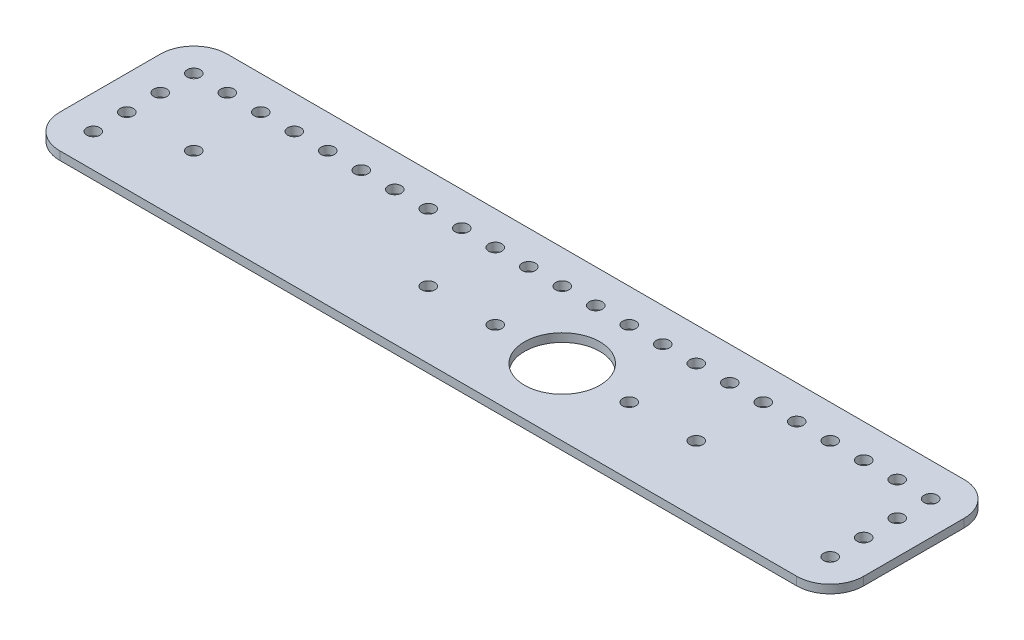
from build123d import *

# Parameters (mm, degrees)
SKETCH1_W           = 254
SKETCH1_H           = 38.1
SKETCH1_R           = 2.4892
BOSS_EXTRUDE1_DEPTH = 3.175
SKETCH3_R           = 2.4892
SKETCH3_R_2         = 14.2875
CUT_EXTRUDE1_DEPTH  = 312.36051552
FILLET1_R           = 12.7


with BuildPart() as part:
    # Sketch1 → Boss-Extrude1 (new body)
    # profile 1 of 2: a face of its own
    with BuildSketch(Plane(origin=(0, 0, 0), x_dir=(1, 0, 0), z_dir=(0, 1, 0))):
        with Locations((152.4, 19.05)):
            Rectangle(SKETCH1_W, SKETCH1_H)
    # profile 2 of 2: a face of its own
    with BuildSketch(Plane(origin=(0, 0, 0), x_dir=(1, 0, 0), z_dir=(0, 1, 0))):
        Polygon((0, 63.5), (0, 0), (25.4, 0), (25.4, 38.1), (279.4, 38.1), (279.4, 0), (304.8, 0), (304.8, 63.5), align=None)
        with Locations(Location((12.7, 12.7, 0), (0, 0, 270))):
            Circle(SKETCH1_R, mode=Mode.SUBTRACT)
        with Locations(Location((12.7, 25.4, 0), (0, 0, 270))):
            Circle(SKETCH1_R, mode=Mode.SUBTRACT)
        with Locations(Location((292.1, 12.7, 0), (0, 0, 270))):
            Circle(SKETCH1_R, mode=Mode.SUBTRACT)
        with Locations(Location((292.1, 25.4, 0), (0, 0, 270))):
            Circle(SKETCH1_R, mode=Mode.SUBTRACT)
        with Locations(Location((12.7, 38.1, 0), (0, 0, 270))):
            Circle(SKETCH1_R, mode=Mode.SUBTRACT)
        with Locations(Location((12.7, 50.8, 0), (0, 0, 270))):
            Circle(SKETCH1_R, mode=Mode.SUBTRACT)
        with Locations(Location((25.4, 50.8, 0), (0, 0, 270))):
            Circle(SKETCH1_R, mode=Mode.SUBTRACT)
        with Locations(Location((38.1, 50.8, 0), (0, 0, 270))):
            Circle(SKETCH1_R, mode=Mode.SUBTRACT)
        with Locations(Location((50.8, 50.8, 0), (0, 0, 270))):
            Circle(SKETCH1_R, mode=Mode.SUBTRACT)
        with Locations(Location((63.5, 50.8, 0), (0, 0, 270))):
            Circle(SKETCH1_R, mode=Mode.SUBTRACT)
        with Locations(Location((76.2, 50.8, 0), (0, 0, 270))):
            Circle(SKETCH1_R, mode=Mode.SUBTRACT)
        with Locations(Location((88.9, 50.8, 0), (0, 0, 270))):
            Circle(SKETCH1_R, mode=Mode.SUBTRACT)
        with Locations(Location((101.6, 50.8, 0), (0, 0, 270))):
            Circle(SKETCH1_R, mode=Mode.SUBTRACT)
        with Locations(Location((114.3, 50.8, 0), (0, 0, 270))):
            Circle(SKETCH1_R, mode=Mode.SUBTRACT)
        with Locations(Location((127, 50.8, 0), (0, 0, 270))):
            Circle(SKETCH1_R, mode=Mode.SUBTRACT)
        with Locations(Location((139.7, 50.8, 0), (0, 0, 270))):
            Circle(SKETCH1_R, mode=Mode.SUBTRACT)
        with Locations(Location((152.4, 50.8, 0), (0, 0, 270))):
            Circle(SKETCH1_R, mode=Mode.SUBTRACT)
        with Locations(Location((292.1, 38.1, 0), (0, 0, 270))):
            Circle(SKETCH1_R, mode=Mode.SUBTRACT)
        with Locations(Location((165.1, 50.8, 0), (0, 0, 270))):
            Circle(SKETCH1_R, mode=Mode.SUBTRACT)
        with Locations(Location((177.8, 50.8, 0), (0, 0, 270))):
            Circle(SKETCH1_R, mode=Mode.SUBTRACT)
        with Locations(Location((190.5, 50.8, 0), (0, 0, 270))):
            Circle(SKETCH1_R, mode=Mode.SUBTRACT)
        with Locations(Location((203.2, 50.8, 0), (0, 0, 270))):
            Circle(SKETCH1_R, mode=Mode.SUBTRACT)
        with Locations(Location((215.9, 50.8, 0), (0, 0, 270))):
            Circle(SKETCH1_R, mode=Mode.SUBTRACT)
        with Locations(Location((228.6, 50.8, 0), (0, 0, 270))):
            Circle(SKETCH1_R, mode=Mode.SUBTRACT)
        with Locations(Location((241.3, 50.8, 0), (0, 0, 270))):
            Circle(SKETCH1_R, mode=Mode.SUBTRACT)
        with Locations(Location((254, 50.8, 0), (0, 0, 270))):
            Circle(SKETCH1_R, mode=Mode.SUBTRACT)
        with Locations(Location((266.7, 50.8, 0), (0, 0, 270))):
            Circle(SKETCH1_R, mode=Mode.SUBTRACT)
        with Locations(Location((279.4, 50.8, 0), (0, 0, 270))):
            Circle(SKETCH1_R, mode=Mode.SUBTRACT)
        with Locations(Location((292.1, 50.8, 0), (0, 0, 270))):
            Circle(SKETCH1_R, mode=Mode.SUBTRACT)
    extrude(amount=BOSS_EXTRUDE1_DEPTH)

    # Sketch3 → Cut-Extrude1 (cut, through all)
    with BuildSketch(Plane(origin=(0, 3.175, 0), x_dir=(1, 0, 0), z_dir=(0, 1, 0))):
        with Locations(Location((126.98924183, 25.4, 0), (0, 0, 270))):
            Circle(SKETCH3_R)
        with Locations(Location((177.78924183, 25.4, 0), (0, 0, 270))):
            Circle(SKETCH3_R_2)
        with Locations(Location((228.58924183, 25.4, 0), (0, 0, 270))):
            Circle(SKETCH3_R)
        with Locations(Location((38.08924183, 25.4, 0), (0, 0, 270))):
            Circle(SKETCH3_R)
        with Locations(Location((152.38924183, 25.4, 0), (0, 0, 270))):
            Circle(SKETCH3_R)
        with Locations(Location((203.18924183, 25.4, 0), (0, 0, 270))):
            Circle(SKETCH3_R)
    extrude(amount=-CUT_EXTRUDE1_DEPTH, mode=Mode.SUBTRACT)

    # Fillet1
    fillet1_edges = [part.edges().sort_by_distance(p)[0] for p in [
        (0, 1.5875, -63.5),
        (304.8, 1.5875, -63.5),
        (304.8, 1.5875, 0),
        (0, 1.5875, 0),
    ]]
    fillet(fillet1_edges, radius=FILLET1_R)


solid = part.part
